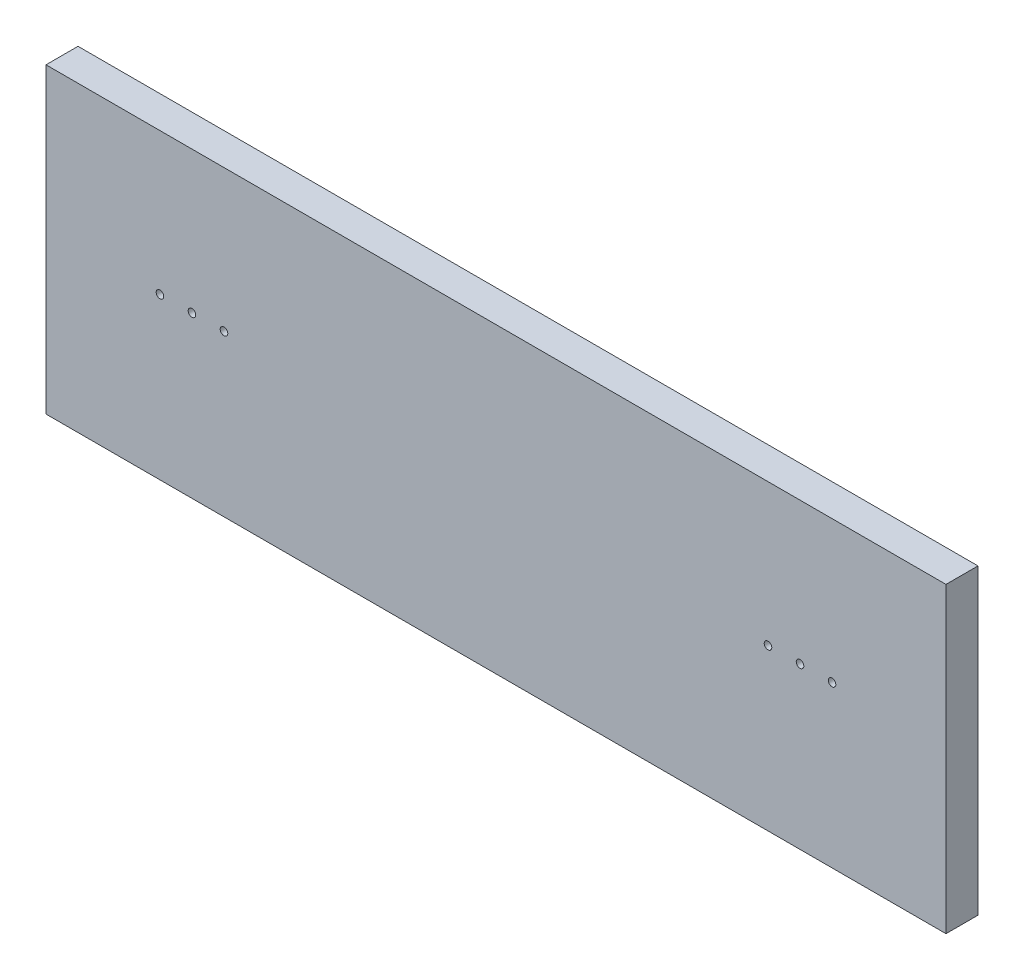
from build123d import *

# Parameters (mm, degrees)
SKETCH_1_W          = 357
SKETCH_1_H          = 120
EXTRUDE_1_DEPTH     = 12.7
SKETCH_2_R          = 1.5
CUT_EXTRUDE_1_DEPTH = 189.741993208


with BuildPart() as part:
    # 草图1 → 凸台-拉伸1 (new body)
    with BuildSketch(Plane.XY):
        Rectangle(SKETCH_1_W, SKETCH_1_H)
    extrude(amount=EXTRUDE_1_DEPTH)

    # 草图2 → 切除-拉伸1 (cut, through all)
    with BuildSketch(Plane.XY.offset(12.7)):
        with Locations((133.3, 3.72)):
            Circle(SKETCH_2_R)
        with Locations((120.6, 3.72)):
            Circle(SKETCH_2_R)
        with Locations((107.9, 3.72)):
            Circle(SKETCH_2_R)
        with Locations(Location((-107.9, 3.72, 0), (0, 0, 180))):
            Circle(SKETCH_2_R)
        with Locations(Location((-120.6, 3.72, 0), (0, 0, 180))):
            Circle(SKETCH_2_R)
        with Locations(Location((-133.3, 3.72, 0), (0, 0, 180))):
            Circle(SKETCH_2_R)
    extrude(amount=-CUT_EXTRUDE_1_DEPTH, mode=Mode.SUBTRACT)


solid = part.part
